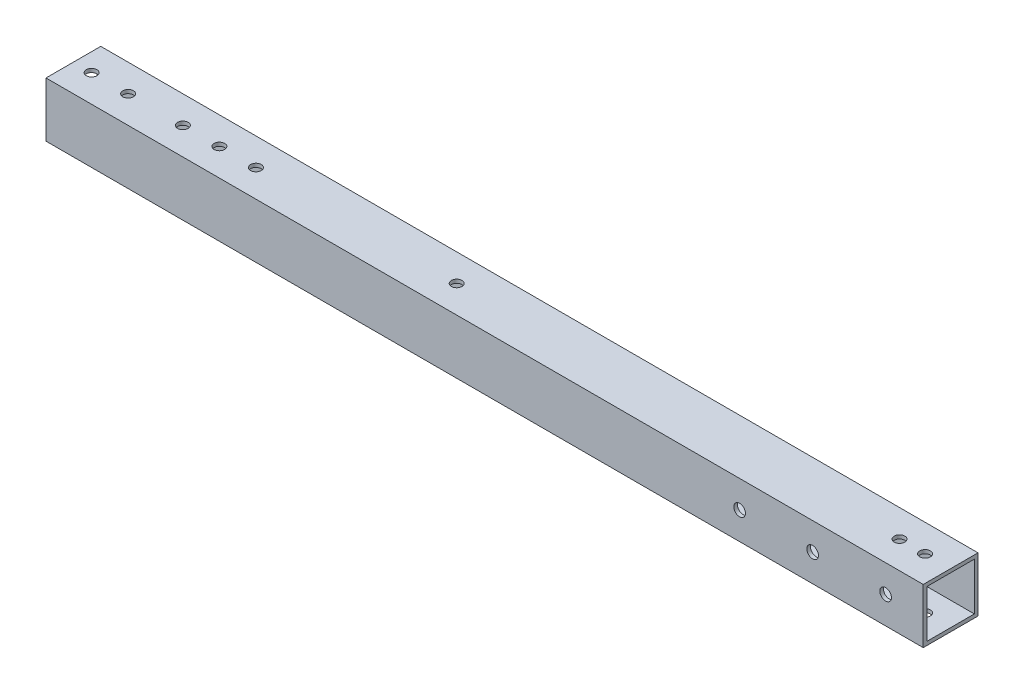
from build123d import *

# Parameters (mm, degrees)
SKETCH_1_W          = 15
SKETCH_1_H          = 15
SKETCH_1_W_2        = 13
SKETCH_1_H_2        = 13
EXTRUDE_1_DEPTH     = 240.3
SKETCH_2_R          = 1.45
CUT_EXTRUDE_1_DEPTH = 241.884495142
SKETCH_3_R          = 1.6
CUT_EXTRUDE_2_DEPTH = 241.884495142


with BuildPart() as part:
    # 草图1 → 凸台-拉伸1 (new body)
    with BuildSketch(Plane(origin=(0, 0, 0), x_dir=(0, 0, -1), z_dir=(1, 0, 0))):
        Rectangle(SKETCH_1_W, SKETCH_1_H)
        Rectangle(SKETCH_1_W_2, SKETCH_1_H_2, mode=Mode.SUBTRACT)
    extrude(amount=EXTRUDE_1_DEPTH)

    # 草图2 → 切除-拉伸1 (cut, through all)
    with BuildSketch(Plane(origin=(0, 7.5, 0), x_dir=(1, 0, 0), z_dir=(0, 1, 0))):
        with Locations(Location((233.3, 0, 0), (0, 0, 270))):
            Circle(SKETCH_2_R)
        with Locations(Location((226.3, 0, 0), (0, 0, 270))):
            Circle(SKETCH_2_R)
        with Locations(Location((14.99848481, 0, 0), (0, 0, 270))):
            Circle(SKETCH_2_R)
        with Locations(Location((4.99848481, 0, 0), (0, 0, 270))):
            Circle(SKETCH_2_R)
        with Locations(Location((29.99848481, 0, 0), (0, 0, 270))):
            Circle(SKETCH_2_R)
        with Locations(Location((39.99848481, 0, 0), (0, 0, 270))):
            Circle(SKETCH_2_R)
        with Locations(Location((49.99848481, 0, 0), (0, 0, 270))):
            Circle(SKETCH_2_R)
        with Locations(Location((104.99848481, 0, 0), (0, 0, 270))):
            Circle(SKETCH_2_R)
    extrude(amount=-CUT_EXTRUDE_1_DEPTH, mode=Mode.SUBTRACT)

    # 草图3 → 切除-拉伸2 (cut, through all)
    with BuildSketch(Plane.XY.offset(7.5)):
        with Locations((229.99848481, 0)):
            Circle(SKETCH_3_R)
        with Locations((189.99848481, 0)):
            Circle(SKETCH_3_R)
        with Locations((209.99848481, 0)):
            Circle(SKETCH_3_R)
    extrude(amount=-CUT_EXTRUDE_2_DEPTH, mode=Mode.SUBTRACT)


solid = part.part
